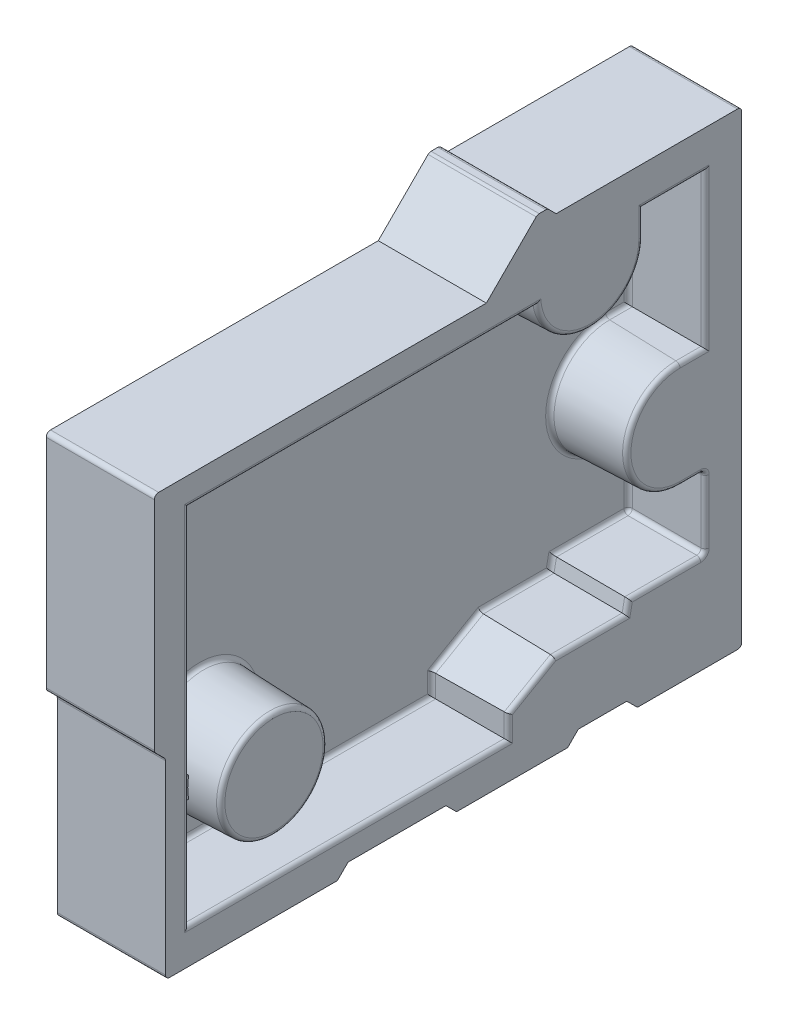
from build123d import *

# Parameters (mm, degrees)
EXTRUDE_1_DEPTH     = 2.54
SKETCH_13_R         = 1.25
CUT_EXTRUDE_1_DEPTH = 1.75
CUT_EXTRUDE_1_DRAFT = 2
SKETCH_15_W         = 0.643121327
SKETCH_15_H         = 0.4
EXTRUDE_2_DEPTH     = 1
EXTRUDE_2_DRAFT     = -2.5
FILLET_1_R          = 0.1
FILLET_2_R          = 0.1


with BuildPart() as part:
    # 草图1 → 凸台-拉伸1 (new body)
    with BuildSketch(Plane(origin=(0, 0, 0), x_dir=(0, 0, -1), z_dir=(1, 0, 0))):
        Polygon((-13.8, 10), (-13.8, 4.76), (-13.54, 4.5), (-13.54, 0), (-9.5, 0), (-9.25, 0.25), (-6.95, 0.25), (-6.7, 0), (-4.09, 0), (-3.84, 0.25), (-2.7, 0.25), (-2.45, 0), (0, 0), (0, 11), (-4.36, 11), (-4.56, 11.2), (-4.8, 11.2), (-6, 10), align=None)
    extrude(amount=EXTRUDE_1_DEPTH)


with BuildPart() as cut_extrude_1_tool:
    # 草图13 → 切除-拉伸1 (with draft: the straight prism first)
    with BuildSketch(Plane.ZY.offset(-2.54)):
        with BuildLine():
            Line((12.99, 9.35), (4.80971771, 9.35))
            ThreePointArc((4.80971771, 9.35), (3.489834974, 8.262573221), (2.32, 9.51))
            Line((2.32, 9.51), (2.32, 10.1))
            Line((2.32, 10.1), (0.86, 10.1))
            Line((0.86, 10.1), (0.86, 6.5))
            Line((0.86, 6.5), (1.45, 6.5))
            ThreePointArc((1.45, 6.5), (2.7, 5.25), (1.45, 4))
            Line((1.45, 4), (0.86, 4))
            Line((0.86, 4), (0.86, 2.3))
            Line((0.86, 2.3), (2.65, 2.3))
            Line((2.65, 2.3), (2.71, 2))
            Line((2.71, 2), (4.4, 2))
            Line((4.4, 2), (5.48, 1.376461709))
            Line((5.48, 1.376461709), (5.48, 0.83))
            Line((5.48, 0.83), (12.99, 0.83))
            Line((12.99, 0.83), (12.99, 9.35))
        make_face()
        with Locations((10.99, 2.9)):
            Circle(SKETCH_13_R, mode=Mode.SUBTRACT)
    extrude(amount=CUT_EXTRUDE_1_DEPTH)
    # 切除-拉伸1: the draft: its side faces are tilted about the plane it starts from
    cut_extrude_1_sides = [cut_extrude_1_tool.faces().sort_by_distance(p)[0] for p in [
        (1.665, 9.35, 8.899858855),
        (1.665, 8.262573221, 3.489834974),
        (1.665, 9.805, 2.32),
        (1.665, 10.1, 1.59),
        (1.665, 8.3, 0.86),
        (1.665, 6.5, 1.155),
        (1.665, 5.25, 2.7),
        (1.665, 4, 1.155),
        (1.665, 3.15, 0.86),
        (1.665, 2.3, 1.755),
        (1.665, 2.15, 2.68),
        (1.665, 2, 3.555),
        (1.665, 1.688230855, 4.94),
        (1.665, 1.103230855, 5.48),
        (1.665, 0.83, 9.235),
        (1.665, 5.09, 12.99),
        (1.665, 2.9, 9.74),
    ]]
    draft(cut_extrude_1_sides, Plane.ZY.offset(-2.54), CUT_EXTRUDE_1_DRAFT)


with BuildPart() as part_1:
    add(part.part)

    # 切除-拉伸1: cut by cut_extrude_1_tool
    add(cut_extrude_1_tool.part, mode=Mode.SUBTRACT)


with BuildPart() as extrude_2_tool:
    # 草图15 → 凸台-拉伸2 (with draft: the straight prism first)
    with BuildSketch(Plane(origin=(0.79, 0, 0), x_dir=(0, 0, -1), z_dir=(1, 0, 0))):
        with Locations((-12.607327989, 2.9)):
            Rectangle(SKETCH_15_W, SKETCH_15_H)
    extrude(amount=EXTRUDE_2_DEPTH)
    # 凸台-拉伸2: the draft: its side faces are tilted about the plane it starts from
    extrude_2_sides = [extrude_2_tool.faces().sort_by_distance(p)[0] for p in [
        (1.29, 2.9, 12.928888653),
        (1.29, 2.7, 12.60732799),
        (1.29, 2.9, 12.285767326),
        (1.29, 3.1, 12.60732799),
    ]]
    draft(extrude_2_sides, Plane(origin=(0.79, 0, 0), x_dir=(0, 0, -1), z_dir=(1, 0, 0)), EXTRUDE_2_DRAFT)


with BuildPart() as part_2:
    add(part_1.part)

    # 凸台-拉伸2: add extrude_2_tool
    add(extrude_2_tool.part)

    # 圆角1
    fillet_1_edges = [part_2.edges().sort_by_distance(p)[0] for p in [
        (2.54, 6.5, 1.155),
        (2.54, 5.25, 2.7),
        (2.54, 4, 1.155),
        (2.54, 9.805, 2.32),
        (1.665, 3.969444327, 0.890555673),
        (2.54, 3.15, 0.86),
        (1.665, 2.330555673, 0.890555673),
        (0.79, 3.1, 12.60732799),
        (0.79, 6.194444327, 12.928888653),
        (0.79, 9.288888653, 8.895610469),
        (0.79, 8.203591854, 3.459046315),
        (0.79, 9.774444327, 2.258888653),
        (0.79, 10.038888653, 1.59),
        (0.79, 8.3, 0.921111347),
        (0.79, 6.561111347, 1.185555673),
        (0.79, 5.25, 2.761111347),
        (0.79, 3.938888653, 1.185555673),
        (0.79, 3.15, 0.921111347),
        (0.79, 2.361111347, 1.810605334),
        (0.79, 2.211111347, 2.73009932),
        (0.79, 2.061111347, 3.588237028),
        (0.79, 1.736427854, 4.978743041),
        (0.79, 1.151427854, 5.541111347),
        (0.79, 0.891111347, 9.235),
        (0.79, 1.795555673, 12.928888653),
        (0.79, 2.7, 12.60732799),
        (0.79, 2.9, 9.678888653),
        (2.54, 8.262573221, 3.489834974),
        (2.54, 10.1, 1.59),
        (2.54, 8.3, 0.86),
        (2.54, 2.15, 2.68),
        (2.54, 2.3, 1.755),
        (2.54, 2, 3.555),
        (2.54, 1.688230855, 4.94),
        (2.54, 1.103230855, 5.48),
        (2.54, 0.83, 9.235),
        (2.54, 5.09, 12.99),
        (2.54, 2.9, 9.74),
        (2.54, 9.35, 8.899858855),
    ]]
    fillet(fillet_1_edges, radius=FILLET_1_R)

    # 圆角2
    fillet_2_edges = [part_2.edges().sort_by_distance(p)[0] for p in [
        (1.27, 11.2, 4.8),
        (1.27, 11.2, 4.56),
        (1.27, 11, 0),
        (1.27, 0, 0),
        (1.27, 0, 13.54),
        (1.27, 4.5, 13.54),
        (1.27, 4.76, 13.8),
        (1.27, 10, 13.8),
    ]]
    fillet(fillet_2_edges, radius=FILLET_2_R)


solid = part_2.part
